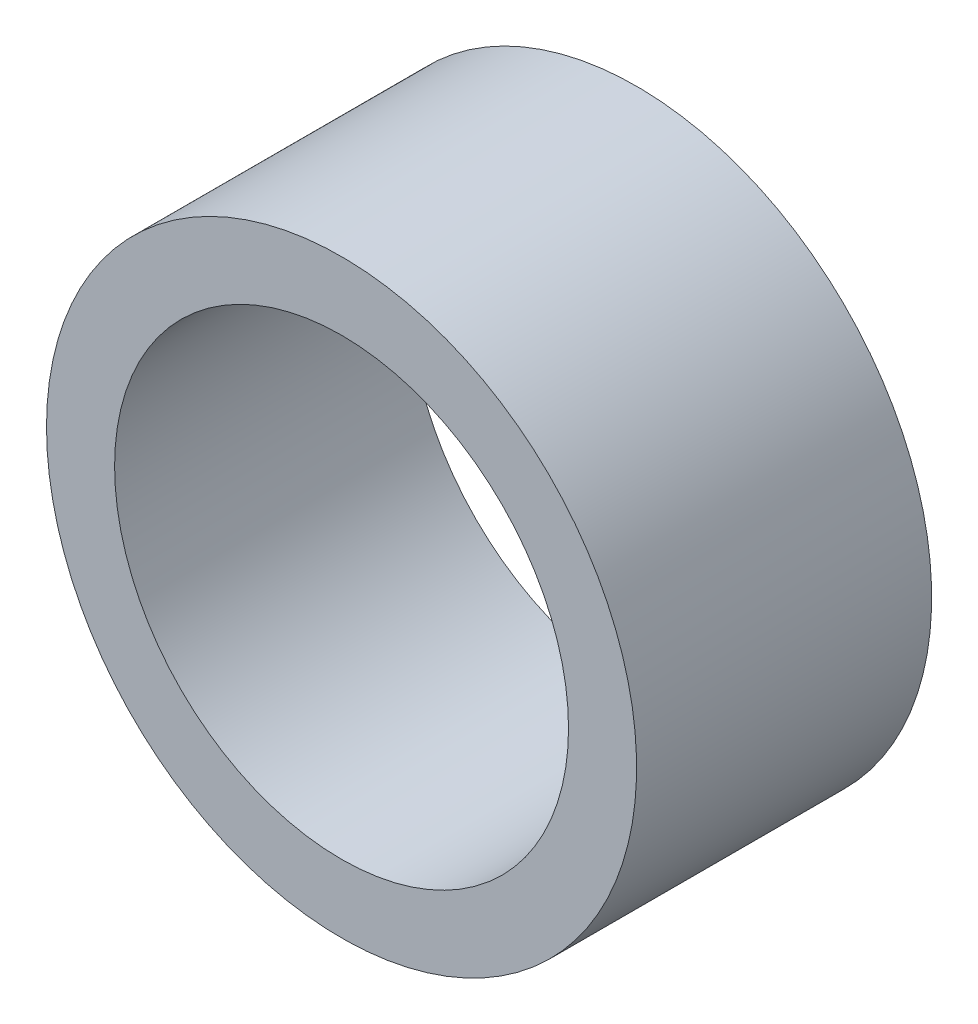
from build123d import *

# Parameters (mm, degrees)
CROQUIS1_R              = 26
CROQUIS1_R_2            = 20
SALIENTE_EXTRUIR1_DEPTH = 26


with BuildPart() as part:
    # Croquis1 → Saliente-Extruir1 (new body)
    with BuildSketch(Plane.XY):
        with Locations(Location((0, 0, 0), (0, 0, 180))):
            Circle(CROQUIS1_R)
        with Locations(Location((0, 0, 0), (0, 0, 180))):
            Circle(CROQUIS1_R_2, mode=Mode.SUBTRACT)
    extrude(amount=SALIENTE_EXTRUIR1_DEPTH)


solid = part.part
